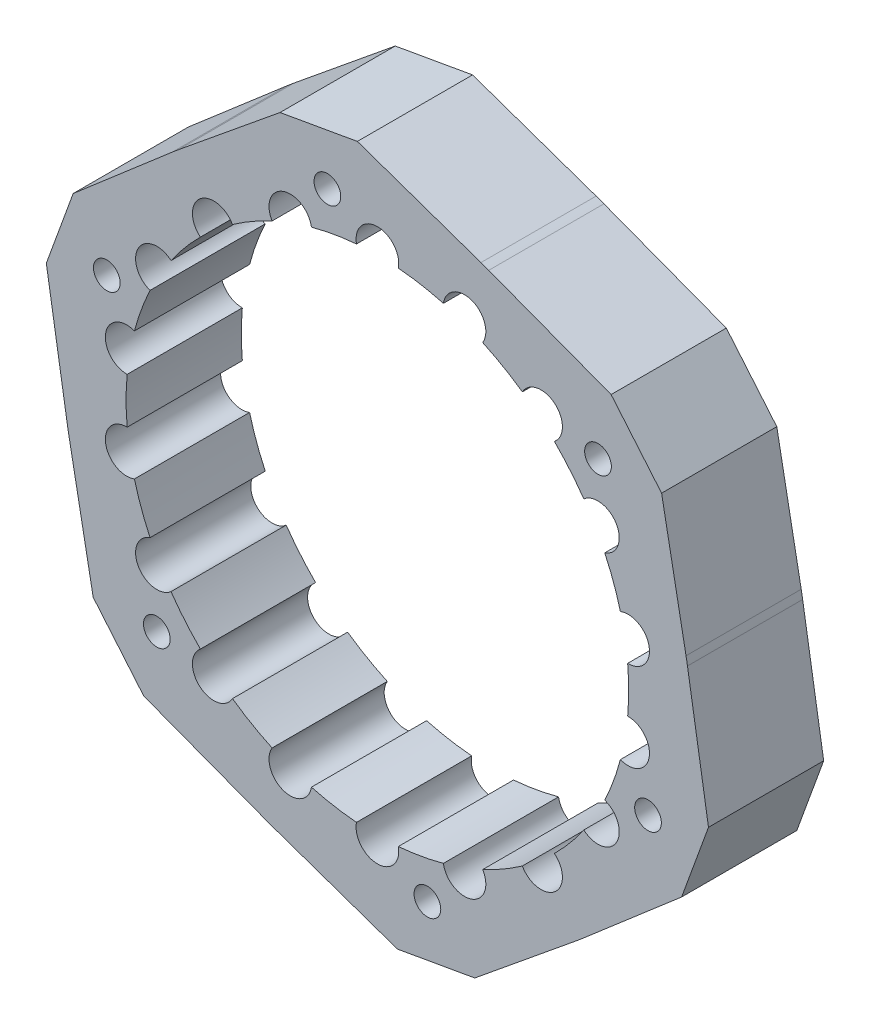
from build123d import *

# Parameters (mm, degrees)
SKETCH1_R           = 60
BOSS_EXTRUDE1_DEPTH = 22
SKETCH2_R           = 2.55
CUT_EXTRUDE2_DEPTH  = 88.658428003
BOSS_EXTRUDE2_START = -22
BOSS_EXTRUDE2_DEPTH = 22


with BuildPart() as part:
    # Sketch1 → Boss-Extrude1 (new body)
    with BuildSketch(Plane.XY):
        Circle(SKETCH1_R)
        with BuildLine():
            ThreePointArc((3.996526269, 47.833333333), (0, 52.704199389), (-3.996526269, 47.833333333))
            ThreePointArc((-3.996526269, 47.833333333), (-8.335112528, 47.270772145), (-12.604457278, 46.315522848))
            ThreePointArc((-12.604457278, 46.315522848), (-18.025897829, 49.52574725), (-20.115469767, 43.581737873))
            ThreePointArc((-20.115469767, 43.581737873), (-24, 41.569219382), (-27.685157256, 39.211376764))
            ThreePointArc((-27.685157256, 39.211376764), (-33.877606345, 40.373759071), (-33.808190737, 34.073541628))
            ThreePointArc((-33.808190737, 34.073541628), (-36.77013327, 30.853805265), (-39.42661868, 27.377759943))
            ThreePointArc((-39.42661868, 27.377759943), (-45.643175557, 26.352099694), (-43.423144949, 20.45557339))
            ThreePointArc((-43.423144949, 20.45557339), (-45.105245798, 16.41696688), (-46.412648015, 12.24198122))
            ThreePointArc((-46.412648015, 12.24198122), (-51.903504174, 9.151988179), (-47.800627023, 4.37036111))
            ThreePointArc((-47.800627023, 4.37036111), (-48, 0), (-47.800627023, -4.37036111))
            ThreePointArc((-47.800627023, -4.37036111), (-51.903504174, -9.151988179), (-46.412648015, -12.24198122))
            ThreePointArc((-46.412648015, -12.24198122), (-45.105245798, -16.41696688), (-43.423144949, -20.45557339))
            ThreePointArc((-43.423144949, -20.45557339), (-45.643175557, -26.352099694), (-39.42661868, -27.377759943))
            ThreePointArc((-39.42661868, -27.377759943), (-36.77013327, -30.853805265), (-33.808190737, -34.073541628))
            ThreePointArc((-33.808190737, -34.073541628), (-33.877606345, -40.373759071), (-27.685157256, -39.211376764))
            ThreePointArc((-27.685157256, -39.211376764), (-24, -41.569219382), (-20.115469767, -43.581737873))
            ThreePointArc((-20.115469767, -43.581737873), (-18.025897829, -49.52574725), (-12.604457278, -46.315522848))
            ThreePointArc((-12.604457278, -46.315522848), (-8.335112528, -47.270772145), (-3.996526269, -47.833333333))
            ThreePointArc((-3.996526269, -47.833333333), (0, -52.704199389), (3.996526269, -47.833333333))
            ThreePointArc((3.996526269, -47.833333333), (8.335112528, -47.270772145), (12.604457278, -46.315522848))
            ThreePointArc((12.604457278, -46.315522848), (18.025897829, -49.52574725), (20.115469767, -43.581737873))
            ThreePointArc((20.115469767, -43.581737873), (24, -41.569219382), (27.685157256, -39.211376764))
            ThreePointArc((27.685157256, -39.211376764), (33.877606345, -40.373759071), (33.808190737, -34.073541628))
            ThreePointArc((33.808190737, -34.073541628), (36.77013327, -30.853805265), (39.42661868, -27.377759943))
            ThreePointArc((39.42661868, -27.377759943), (45.643175557, -26.352099694), (43.423144949, -20.45557339))
            ThreePointArc((43.423144949, -20.45557339), (45.105245798, -16.41696688), (46.412648015, -12.24198122))
            ThreePointArc((46.412648015, -12.24198122), (51.903504174, -9.151988179), (47.800627023, -4.37036111))
            ThreePointArc((47.800627023, -4.37036111), (48, 0), (47.800627023, 4.37036111))
            ThreePointArc((47.800627023, 4.37036111), (51.903504174, 9.151988179), (46.412648015, 12.24198122))
            ThreePointArc((46.412648015, 12.24198122), (45.105245798, 16.41696688), (43.423144949, 20.45557339))
            ThreePointArc((43.423144949, 20.45557339), (45.643175557, 26.352099694), (39.42661868, 27.377759943))
            ThreePointArc((39.42661868, 27.377759943), (36.77013327, 30.853805265), (33.808190737, 34.073541628))
            ThreePointArc((33.808190737, 34.073541628), (33.877606345, 40.373759071), (27.685157256, 39.211376764))
            ThreePointArc((27.685157256, 39.211376764), (24, 41.569219382), (20.115469767, 43.581737873))
            ThreePointArc((20.115469767, 43.581737873), (18.025897829, 49.52574725), (12.604457278, 46.315522848))
            ThreePointArc((12.604457278, 46.315522848), (8.335112528, 47.270772145), (3.996526269, 47.833333333))
        make_face(mode=Mode.SUBTRACT)
    extrude(amount=BOSS_EXTRUDE1_DEPTH)

    # Sketch2 → Cut-Extrude2 (cut, through all)
    with BuildSketch(Plane.XY.offset(22)):
        with Locations((-9.550649772, 54.164426416)):
            Circle(SKETCH2_R)
        with Locations((42.132444372, 35.353318533)):
            Circle(SKETCH2_R)
        with Locations((51.683094143, -18.811107883)):
            Circle(SKETCH2_R)
        with Locations((9.550649772, -54.164426416)):
            Circle(SKETCH2_R)
        with Locations((-42.132444372, -35.353318533)):
            Circle(SKETCH2_R)
        with Locations((-51.683094143, 18.811107883)):
            Circle(SKETCH2_R)
    extrude(amount=-CUT_EXTRUDE2_DEPTH, mode=Mode.SUBTRACT)

    # Sketch3 → Boss-Extrude2 (add)
    with BuildSketch(Plane.XY.offset(22).offset(BOSS_EXTRUDE2_START)):
        with BuildLine():
            Line((-37.958811886, 46.46642444), (-18.597801703, 62.282596059))
            Line((-18.597801703, 62.282596059), (-3.825685408, 64.887318724))
            Line((-3.825685408, 64.887318724), (19.777162276, 56.646834442))
            ThreePointArc((19.777162276, 56.646834442), (-10.41889066, 59.088465181), (-37.958811886, 46.46642444))
        make_face()
        with BuildLine():
            Line((54.281223694, 35.756800112), (58.946178809, 11.195892275))
            ThreePointArc((58.946178809, 11.195892275), (45.962666587, 38.567256581), (21.261698045, 56.106507611))
            Line((21.261698045, 56.106507611), (44.639409549, 47.247466759))
            Line((44.639409549, 47.247466759), (54.281223694, 35.756800112))
        make_face()
        with BuildLine():
            Line((58.106909102, -29.130518612), (39.169016532, -45.450942167))
            ThreePointArc((39.169016532, -45.450942167), (56.381557247, -20.5212086), (59.220509931, 9.640083171))
            Line((59.220509931, 9.640083171), (63.237211252, -15.0351293))
            Line((63.237211252, -15.0351293), (58.106909102, -29.130518612))
        make_face()
        with BuildLine():
            Line((3.825685408, -64.887318724), (-19.777162276, -56.646834442))
            ThreePointArc((-19.777162276, -56.646834442), (10.41889066, -59.088465181), (37.958811886, -46.46642444))
            Line((37.958811886, -46.46642444), (18.597801703, -62.282596059))
            Line((18.597801703, -62.282596059), (3.825685408, -64.887318724))
        make_face()
        with BuildLine():
            Line((-54.281223694, -35.756800112), (-58.946178809, -11.195892275))
            ThreePointArc((-58.946178809, -11.195892275), (-45.962666587, -38.567256581), (-21.261698045, -56.106507611))
            Line((-21.261698045, -56.106507611), (-44.639409549, -47.247466759))
            Line((-44.639409549, -47.247466759), (-54.281223694, -35.756800112))
        make_face()
        with BuildLine():
            Line((-58.106909102, 29.130518612), (-39.169016532, 45.450942167))
            ThreePointArc((-39.169016532, 45.450942167), (-56.381557247, 20.5212086), (-59.220509931, -9.640083171))
            Line((-59.220509931, -9.640083171), (-63.237211252, 15.0351293))
            Line((-63.237211252, 15.0351293), (-58.106909102, 29.130518612))
        make_face()
    extrude(amount=BOSS_EXTRUDE2_DEPTH)


solid = part.part
